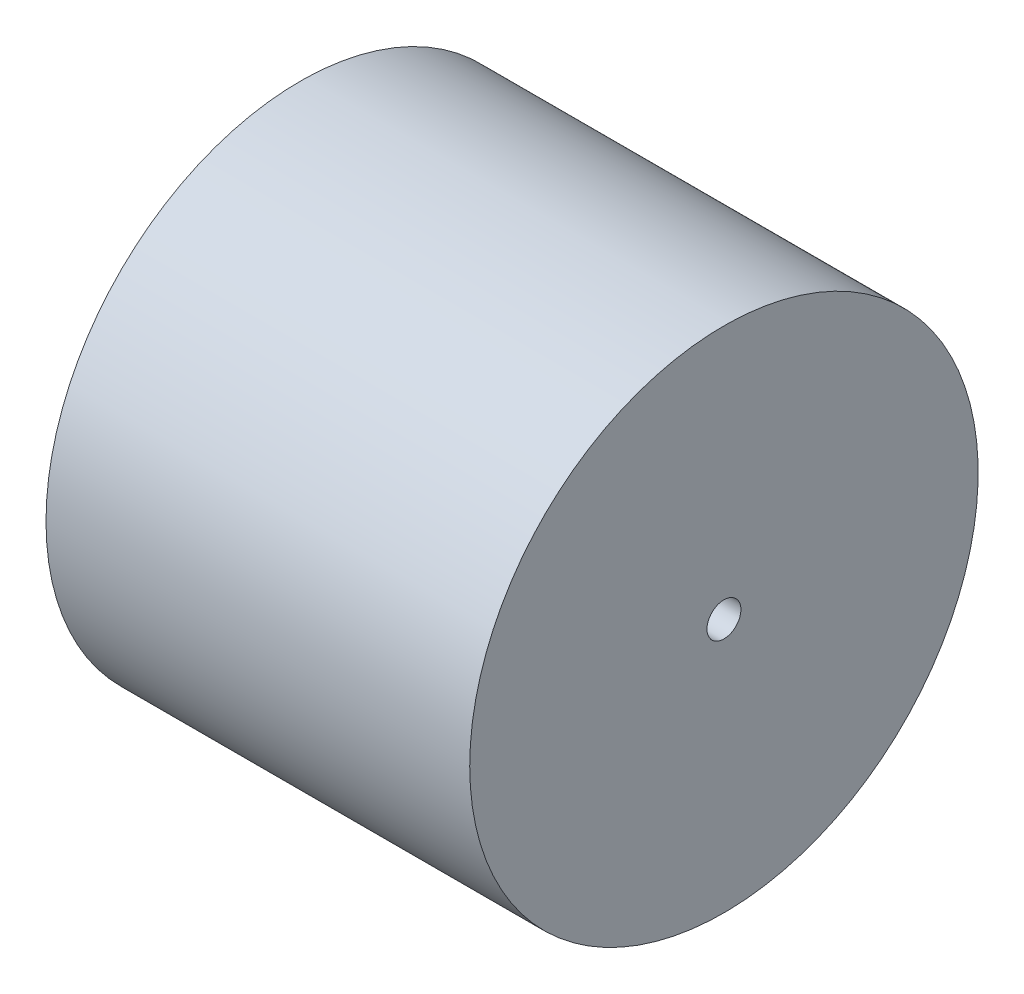
from build123d import *

# Parameters (mm, degrees)
SKETCH1_W           = 30
SKETCH1_H           = 18
SKETCH2_R           = 1.2
CUT_EXTRUDE1_DEPTH  = 4
SKETCH3_R           = 3.5
BOSS_EXTRUDE1_DEPTH = 1.5
FILLET1_R           = 0.25
SKETCH4_R           = 1.65
CUT_EXTRUDE2_DEPTH  = 2


with BuildPart() as part:
    # Sketch1 → Revolve1 (revolve)
    with BuildSketch(Plane.XY, mode=Mode.PRIVATE) as revolve1_sk:
        with Locations((-10, 9)):
            Rectangle(SKETCH1_W, SKETCH1_H)
    revolve(revolve1_sk.sketch.rotate(Axis((-25, 0, 0), (1, 0, 0)), 90), axis=Axis((-25, 0, 0), (1, 0, 0)))

    # Sketch2 → Cut-Extrude1 (cut)
    with BuildSketch(Plane(origin=(5, 0, 0), x_dir=(0, 0, -1), z_dir=(1, 0, 0))):
        Circle(SKETCH2_R)
    extrude(amount=-CUT_EXTRUDE1_DEPTH, mode=Mode.SUBTRACT)

    # Sketch3 → Boss-Extrude1 (add)
    with BuildSketch(Plane.ZY.offset(25)):
        Circle(SKETCH3_R)
    extrude(amount=BOSS_EXTRUDE1_DEPTH)

    # Fillet1
    fillet1_edges = [part.edges().sort_by_distance(p)[0] for p in [
        (-26.5, 0, -3.5),
    ]]
    fillet(fillet1_edges, radius=FILLET1_R)

    # Sketch4 → Cut-Extrude2 (cut)
    with BuildSketch(Plane.ZY.offset(25)):
        with Locations((-12, 0)):
            Circle(SKETCH4_R)
        with Locations((12, 0)):
            Circle(SKETCH4_R)
    extrude(amount=-CUT_EXTRUDE2_DEPTH, mode=Mode.SUBTRACT)


solid = part.part
